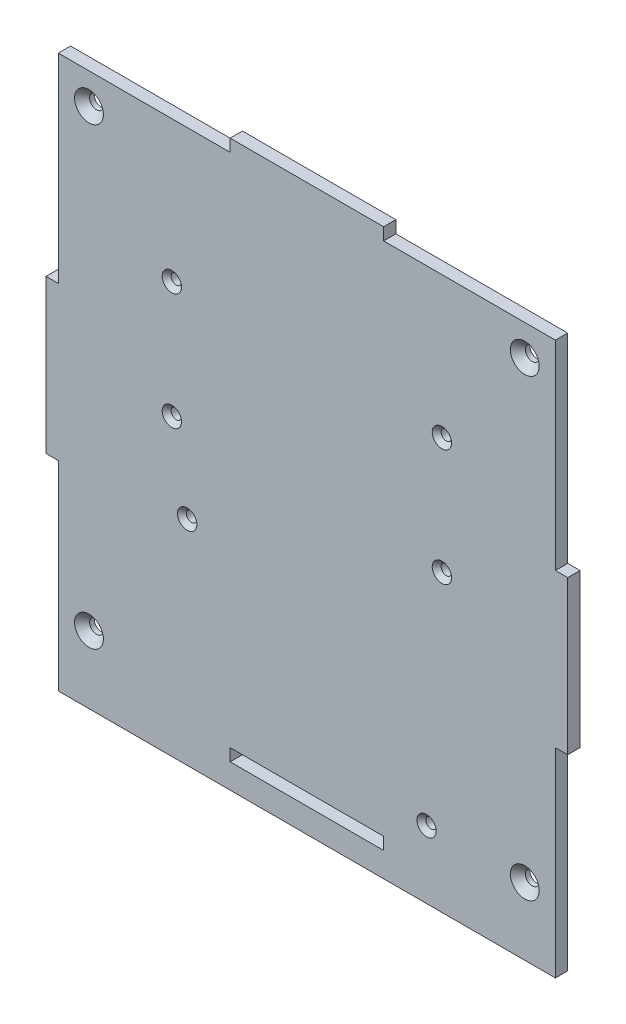
from build123d import *

# Parameters (mm, degrees)
SKETCH1_W                                           = 162
SKETCH1_H                                           = 180
SKETCH1_W_2                                         = 50
SKETCH1_H_2                                         = 4
SKETCH1_W_3                                         = 4
SKETCH1_H_3                                         = 50
BOSS_EXTRUDE2_DEPTH                                 = 4
CUT_EXTRUDE1_REACH                                  = 136.376
SKETCH2_W                                           = 50
SKETCH2_H                                           = 4
CSK_FOR_M3_COUNTERSUNK_FLAT_HEAD_SCREW1_D           = 3.4
CSK_FOR_M3_COUNTERSUNK_FLAT_HEAD_SCREW1_CSINK_D     = 6.3
CSK_FOR_M3_COUNTERSUNK_FLAT_HEAD_SCREW1_CSINK_ANGLE = 90
CSK_FOR_M4_COUNTERSUNK_FLAT_HEAD_SCR_2_COUNT        = 2
CSK_FOR_M4_COUNTERSUNK_FLAT_HEAD_SCR_2_PITCH        = 142
CSK_FOR_M4_COUNTERSUNK_FLAT_HEAD_SCR_3_COUNT        = 2
CSK_FOR_M4_COUNTERSUNK_FLAT_HEAD_SCR_3_PITCH        = 205.104851235
CSK_FOR_M4_COUNTERSUNK_FLAT_HEAD_SCR_4_COUNT        = 2
CSK_FOR_M4_COUNTERSUNK_FLAT_HEAD_SCR_4_PITCH        = 148
CSK_FOR_M3_COUNTERSUNK_FLAT_HEAD_SCREW3_D           = 3.4
CSK_FOR_M3_COUNTERSUNK_FLAT_HEAD_SCREW3_CSINK_D     = 6.3
CSK_FOR_M3_COUNTERSUNK_FLAT_HEAD_SCREW3_CSINK_ANGLE = 90


with BuildPart() as part:
    # Sketch1 → Boss-Extrude2 (new body)
    with BuildSketch(Plane.XY):
        with Locations((0, 10)):
            Rectangle(SKETCH1_W, SKETCH1_H)
        with Locations((0, 102)):
            Rectangle(SKETCH1_W_2, SKETCH1_H_2)
        with Locations((83, 10)):
            Rectangle(SKETCH1_W_3, SKETCH1_H_3)
        with Locations((-83, 10)):
            Rectangle(SKETCH1_W_3, SKETCH1_H_3)
    extrude(amount=BOSS_EXTRUDE2_DEPTH)

    # Sketch2 → Cut-Extrude1 (cut, up to next)
    with BuildSketch(Plane.XY.offset(4), mode=Mode.PRIVATE) as cut_extrude1_sk1:
        with Locations((0, -70)):
            Rectangle(SKETCH2_W, SKETCH2_H)
    cut_extrude1_tool1 = extrude(cut_extrude1_sk1.sketch, amount=-CUT_EXTRUDE1_REACH, mode=Mode.PRIVATE) & part.part
    add(cut_extrude1_tool1.solids().sort_by_distance((0, -70, 4))[0], mode=Mode.SUBTRACT)

    # CSK for M3 Countersunk Flat Head Screw1 (through all)
    with Locations(Plane(origin=(-44, 54, 4), x_dir=(1, 0, 0), z_dir=(0, 0, 1))):
        with Locations((0, 0), (88, 0), (88, -38), (0, -38)):
            CounterSinkHole(CSK_FOR_M3_COUNTERSUNK_FLAT_HEAD_SCREW1_D / 2, CSK_FOR_M3_COUNTERSUNK_FLAT_HEAD_SCREW1_CSINK_D / 2, counter_sink_angle=CSK_FOR_M3_COUNTERSUNK_FLAT_HEAD_SCREW1_CSINK_ANGLE)

    # Sketch6 → CSK for M4 Countersunk Flat Head Screw1 (revolve, cut)
    with BuildSketch(Plane(origin=(-71, 90, 4), x_dir=(0, -1, 0), z_dir=(1, 0, 0))):
        Polygon((0, 0), (0, 4), (2.25, 4), (2.25, 2.45), (4.7, 0), align=None)
    csk_for_m4_countersunk_flat_head_screw1 = revolve(axis=Axis((-71, 90, 10.35), (0, 0, -1)), mode=Mode.SUBTRACT)

    # CSK for M4 Countersunk Flat Head Scr 2: CSK for M4 Countersunk Flat Head Screw1 ×2
    with Locations(*[(i * CSK_FOR_M4_COUNTERSUNK_FLAT_HEAD_SCR_2_PITCH, 0, 0) for i in range(1, CSK_FOR_M4_COUNTERSUNK_FLAT_HEAD_SCR_2_COUNT)]):
        add(csk_for_m4_countersunk_flat_head_screw1, mode=Mode.SUBTRACT)

    # CSK for M4 Countersunk Flat Head Scr 3: CSK for M4 Countersunk Flat Head Screw1 ×2
    with Locations(*[Vector(0.6923288217962463, -0.7215821522946791, 0) * (i * CSK_FOR_M4_COUNTERSUNK_FLAT_HEAD_SCR_3_PITCH) for i in range(1, CSK_FOR_M4_COUNTERSUNK_FLAT_HEAD_SCR_3_COUNT)]):
        add(csk_for_m4_countersunk_flat_head_screw1, mode=Mode.SUBTRACT)

    # CSK for M4 Countersunk Flat Head Scr 4: CSK for M4 Countersunk Flat Head Screw1 ×2
    with Locations(*[(0, -i * CSK_FOR_M4_COUNTERSUNK_FLAT_HEAD_SCR_4_PITCH, 0) for i in range(1, CSK_FOR_M4_COUNTERSUNK_FLAT_HEAD_SCR_4_COUNT)]):
        add(csk_for_m4_countersunk_flat_head_screw1, mode=Mode.SUBTRACT)

    # CSK for M3 Countersunk Flat Head Screw3 (through all)
    with Locations(Plane(origin=(-39, -10.5, 4), x_dir=(1, 0, 0), z_dir=(0, 0, 1))):
        with Locations((0, 0), (78, -47.5)):
            CounterSinkHole(CSK_FOR_M3_COUNTERSUNK_FLAT_HEAD_SCREW3_D / 2, CSK_FOR_M3_COUNTERSUNK_FLAT_HEAD_SCREW3_CSINK_D / 2, counter_sink_angle=CSK_FOR_M3_COUNTERSUNK_FLAT_HEAD_SCREW3_CSINK_ANGLE)


solid = part.part
